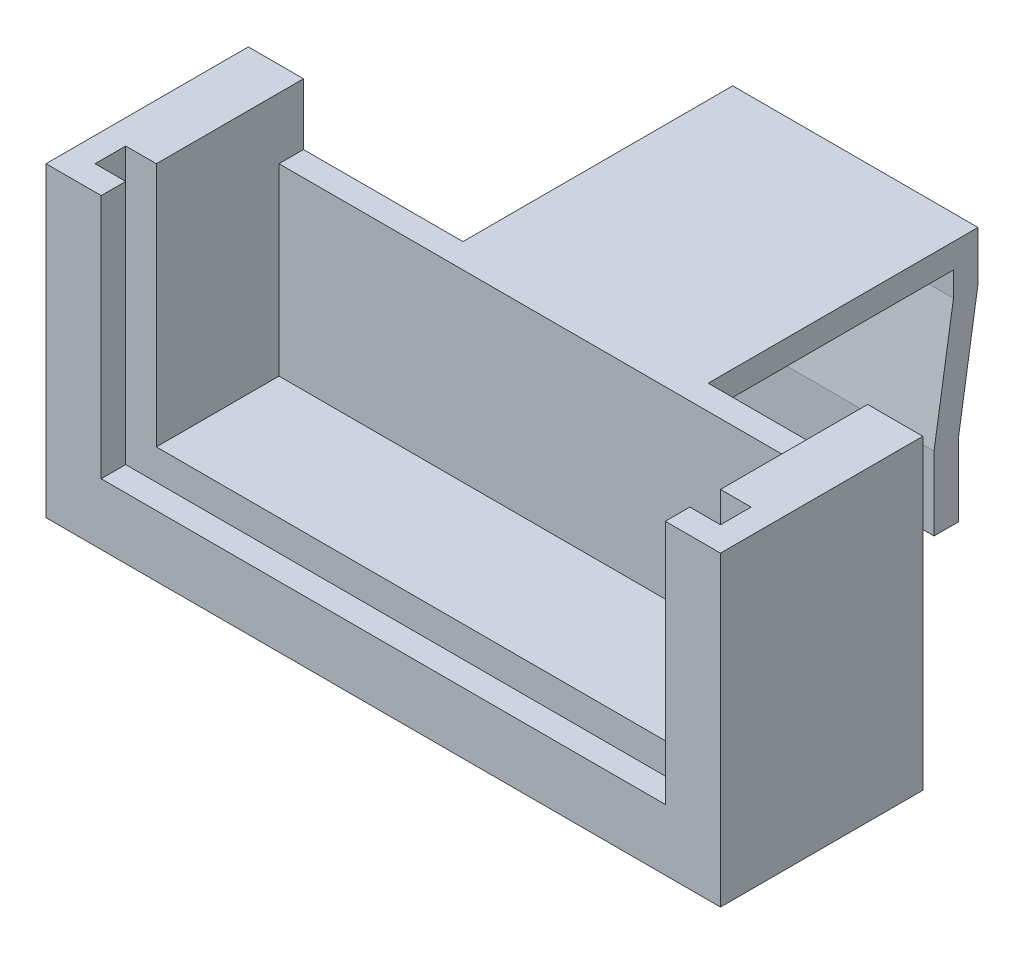
from build123d import *

# Parameters (mm, degrees)
SKETCH1_W           = 55
SKETCH1_H           = 25
BOSS_EXTRUDE1_DEPTH = 16.5
SKETCH2_W           = 46
SKETCH2_H           = 20
CUT_EXTRUDE1_DEPTH  = 14.5
SKETCH3_W           = 2.5
SKETCH3_H           = 20
CUT_EXTRUDE2_DEPTH  = 2.5
CUT_EXTRUDE3_DEPTH  = 3
CUT_EXTRUDE4_DEPTH  = 63.130910182
SKETCH8_W           = 20
SKETCH8_H           = 2
BOSS_EXTRUDE2_DEPTH = 22
SKETCH9_W           = 20
SKETCH9_H           = 2
BOSS_EXTRUDE3_DEPTH = 2
BOSS_EXTRUDE4_DEPTH = 20


with BuildPart() as part:
    # Sketch1 → Boss-Extrude1 (new body)
    with BuildSketch(Plane.XY):
        with Locations((27.5, 12.5)):
            Rectangle(SKETCH1_W, SKETCH1_H)
    extrude(amount=BOSS_EXTRUDE1_DEPTH)

    # Sketch2 → Cut-Extrude1 (cut)
    with BuildSketch(Plane.XY.offset(16.5)):
        with Locations((27.5, 15)):
            Rectangle(SKETCH2_W, SKETCH2_H)
    extrude(amount=-CUT_EXTRUDE1_DEPTH, mode=Mode.SUBTRACT)

    # Sketch3 → Cut-Extrude2 (cut)
    with BuildSketch(Plane(origin=(4.5, 0, 0), x_dir=(0, 0, -1), z_dir=(1, 0, 0))):
        with Locations((-13.25, 15)):
            Rectangle(SKETCH3_W, SKETCH3_H)
    cut_extrude2 = extrude(amount=-CUT_EXTRUDE2_DEPTH, mode=Mode.SUBTRACT)

    # Mirror1: Cut-Extrude2 across plane
    add(cut_extrude2.mirror(Plane(origin=(27.5, 0, 0), x_dir=(0, 0, 1), z_dir=(1, 0, 0))), mode=Mode.SUBTRACT)

    # Sketch4 → Cut-Extrude3 (cut)
    with BuildSketch(Plane(origin=(0, 5, 0), x_dir=(1, 0, 0), z_dir=(0, 1, 0))):
        Polygon((4.5, -12), (50.5, -12), (53, -12), (53, -14.5), (50.5, -14.5), (4.5, -14.5), (2, -14.5), (2, -12), align=None)
    extrude(amount=-CUT_EXTRUDE3_DEPTH, mode=Mode.SUBTRACT)

    # Sketch6 → Cut-Extrude4 (cut, through all)
    with BuildSketch(Plane.XY.offset(2)):
        Polygon((27.5, 20), (4.5, 20), (4.5, 25), (50.5, 25), (50.5, 20), align=None)
    extrude(amount=-CUT_EXTRUDE4_DEPTH, mode=Mode.SUBTRACT)

    # Sketch8 → Boss-Extrude2 (add)
    with BuildSketch(Plane(origin=(0, 0, 0), x_dir=(-1, 0, 0), z_dir=(0, 0, -1))):
        with Locations((-27.5, 19)):
            Rectangle(SKETCH8_W, SKETCH8_H)
    extrude(amount=BOSS_EXTRUDE2_DEPTH)

    # Sketch9 → Boss-Extrude3 (add)
    with BuildSketch(Plane.XZ.offset(-18)):
        with Locations((27.5, -21)):
            Rectangle(SKETCH9_W, SKETCH9_H)
    extrude(amount=BOSS_EXTRUDE3_DEPTH)

    # Sketch10 → Boss-Extrude4 (add)
    with BuildSketch(Plane(origin=(37.5, 0, 0), x_dir=(0, 0, -1), z_dir=(1, 0, 0))):
        Polygon((20, 16), (18.416155597, 6), (18.416155597, 0), (20.416155597, 0), (20.416155597, 6), (22, 16), align=None)
    extrude(amount=-BOSS_EXTRUDE4_DEPTH)


solid = part.part
